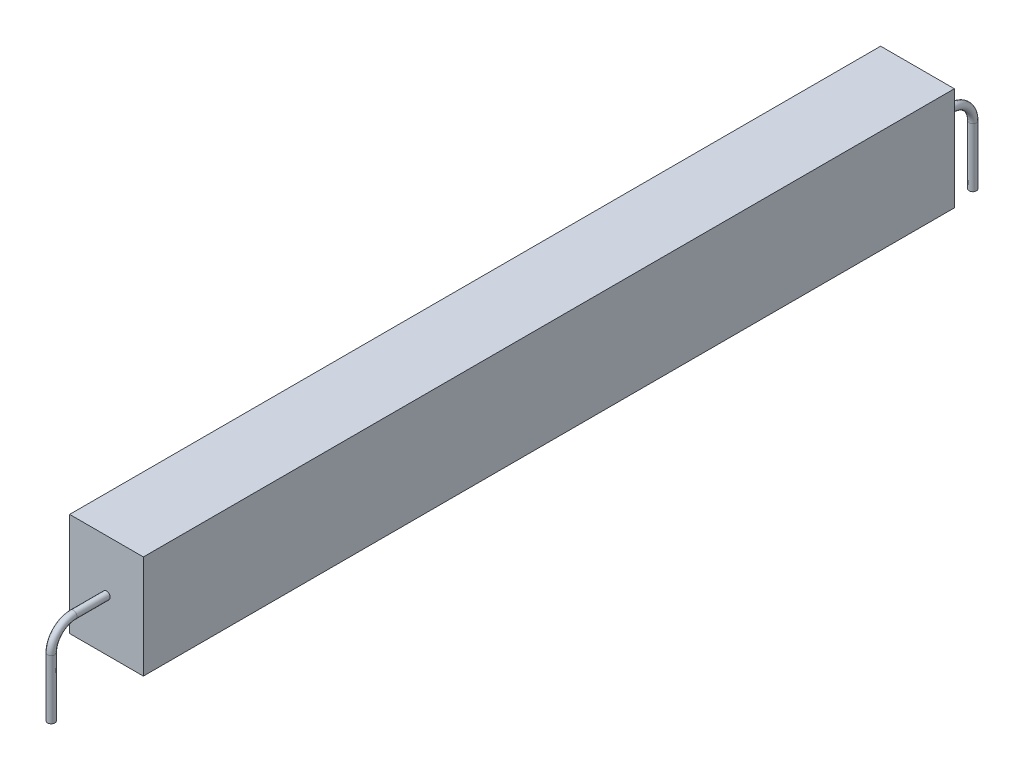
from build123d import *

# Parameters (mm, degrees)
SKETCH_1_W      = 10
SKETCH_1_H      = 14
EXTRUDE_1_DEPTH = 55
SKETCH_3_R      = 0.5


with BuildPart() as part:
    # Эскиз1 → Бобышка-Вытянуть1 (new, symmetric)
    with BuildSketch(Plane.XY):
        with Locations((0, 7)):
            Rectangle(SKETCH_1_W, SKETCH_1_H)
    extrude(amount=EXTRUDE_1_DEPTH, both=True)

    # По траектории1: sweep along a path in Эскиз4
    with BuildLine(Plane(origin=(0, 0, 0), x_dir=(0, 0, -1), z_dir=(1, 0, 0))) as sweep_1_path:
        Line((-62.5, -4), (-62.5, 4))
        ThreePointArc((-62.5, 4), (-61.621320344, 6.121320344), (-59.5, 7))
        Line((-59.5, 7), (-55, 7))
    # Эскиз3 → По траектории1 (sweep)
    with BuildSketch(Plane.XY.offset(55)):
        with Locations((0, 7)):
            Circle(SKETCH_3_R)
    sweep_1 = sweep(path=sweep_1_path.line)

    # Зеркальное отражение1: По траектории1 across plane
    add(sweep_1.mirror(Plane.XY))


solid = part.part
